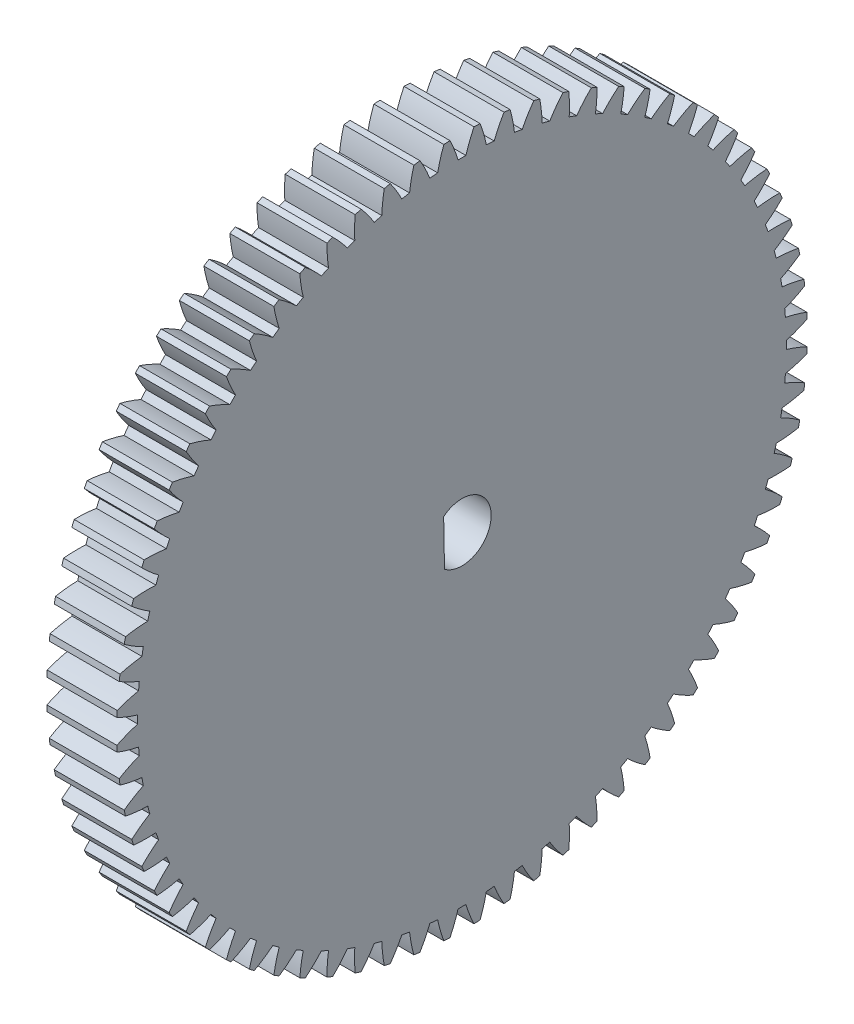
from build123d import *

# Parameters (mm, degrees)
BASPROSKE_W         = 6
BASPROSKE_H         = 29.6
TOOTHCUT_DEPTH      = 43.288532725
TEETHCUTS_COUNT     = 72
TEETHCUTS_ANGLE     = 355
BORSKE_R            = 2.5
BORE_DEPTH          = 50.0002032
BOSS_EXTRUDE1_DEPTH = 6


with BuildPart() as part:
    # BasProSke → Base-Revolve (revolve)
    with BuildSketch(Plane(origin=(0, 0, 0), x_dir=(1, 0, 0), z_dir=(0, 1, 0)), mode=Mode.PRIVATE) as base_revolve_sk:
        with Locations((3, 14.8)):
            Rectangle(BASPROSKE_W, BASPROSKE_H)
    revolve(base_revolve_sk.sketch.rotate(Axis((-10, 0, 0), (1, 0, 0)), 180), axis=Axis((-10, 0, 0), (1, 0, 0)))

    # TooCutSke → ToothCut (cut, through all)
    with BuildSketch(Plane(origin=(0, 0, 0), x_dir=(0, 0, -1), z_dir=(1, 0, 0))):
        with BuildLine():
            ThreePointArc((0.338290296, 27.796941571), (0, 27.799), (-0.338290296, 27.796941571))
            ThreePointArc((-0.338290296, 27.796941571), (-0.651320013, 28.71685386), (-1.04076178, 29.607112998))
            ThreePointArc((-1.04076178, 29.607112998), (0, 29.6254), (1.04076178, 29.607112998))
            ThreePointArc((1.04076178, 29.607112998), (0.651320013, 28.71685386), (0.338290296, 27.796941571))
        make_face()
    toothcut = extrude(amount=TOOTHCUT_DEPTH, mode=Mode.SUBTRACT)

    # TeethCuts: ToothCut ×72 about axis
    teethcuts_axis = Axis((-10, 0, 0), (1, 0, 0))
    for i in range(1, TEETHCUTS_COUNT):
        add(toothcut.rotate(teethcuts_axis, i * TEETHCUTS_ANGLE / (TEETHCUTS_COUNT - 1)), mode=Mode.SUBTRACT)

    # BorSke → Bore (cut, symmetric)
    with BuildSketch(Plane(origin=(0, 0, 0), x_dir=(0, 0, -1), z_dir=(1, 0, 0))):
        with Locations(Location((0, 0, 0), (0, 0, 180))):
            Circle(BORSKE_R)
    extrude(amount=BORE_DEPTH, both=True, mode=Mode.SUBTRACT)

    # Sketch1 → Boss-Extrude1 (add)
    with BuildSketch(Plane(origin=(6, 0, 0), x_dir=(0, 0, -1), z_dir=(1, 0, 0))):
        with BuildLine():
            ThreePointArc((-1.572374853, 1.943614499), (-2.256206676, 1.076815413), (-2.5, 0))
            Line((-2.5, 0), (-1.536704832, 0))
            Line((-1.536704832, 0), (-1.572374853, 1.943614499))
        make_face()
        with BuildLine():
            Line((-1.536704832, 0), (-2.5, 0))
            ThreePointArc((-2.5, 0), (-2.236067977, -1.118033989), (-1.5, -2))
            Line((-1.5, -2), (-1.536704832, 0))
        make_face()
    extrude(amount=-BOSS_EXTRUDE1_DEPTH)


solid = part.part
